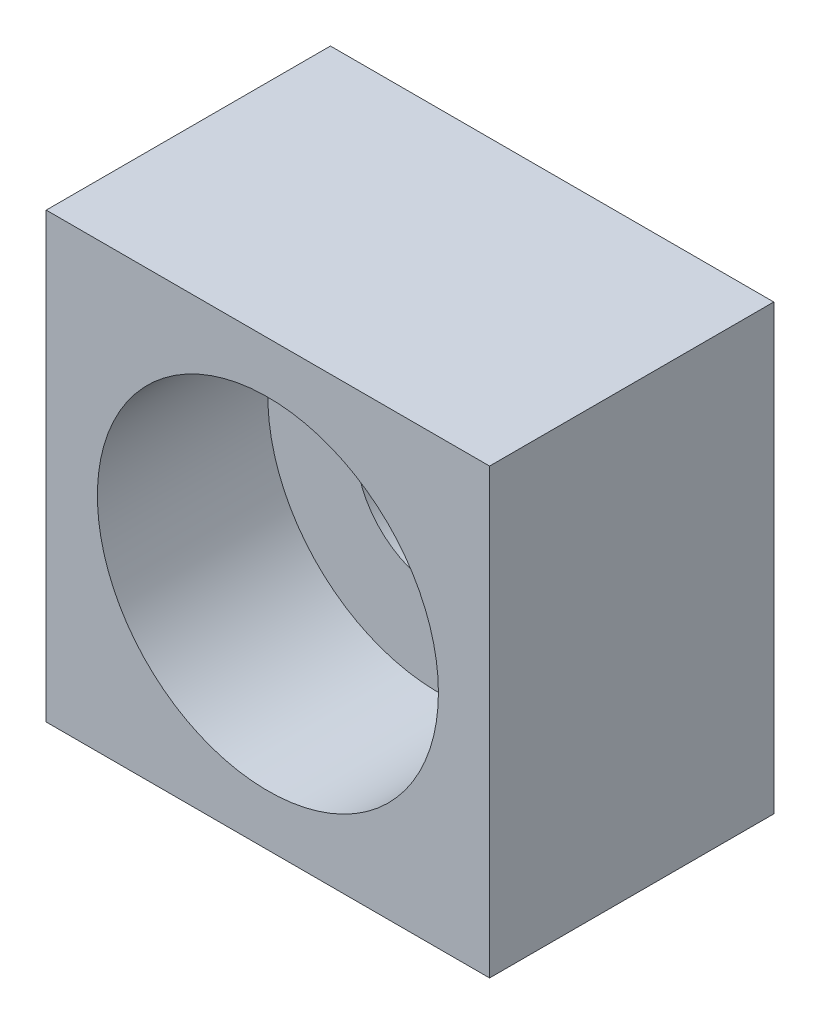
from build123d import *

# Parameters (mm, degrees)
SKETCH_1_W          = 7.8
SKETCH_1_H          = 7.8
SKETCH_1_R          = 1.45
EXTRUDE_1_DEPTH     = 5
SKETCH_2_R          = 3
CUT_EXTRUDE_1_DEPTH = 3


with BuildPart() as part:
    # Эскиз1 → Бобышка-Вытянуть1 (new body)
    with BuildSketch(Plane.XY):
        Rectangle(SKETCH_1_W, SKETCH_1_H)
        Circle(SKETCH_1_R, mode=Mode.SUBTRACT)
    extrude(amount=EXTRUDE_1_DEPTH)

    # Эскиз2 → Вырез-Вытянуть1 (cut)
    with BuildSketch(Plane.XY.offset(5)):
        Circle(SKETCH_2_R)
    extrude(amount=-CUT_EXTRUDE_1_DEPTH, mode=Mode.SUBTRACT)


solid = part.part
